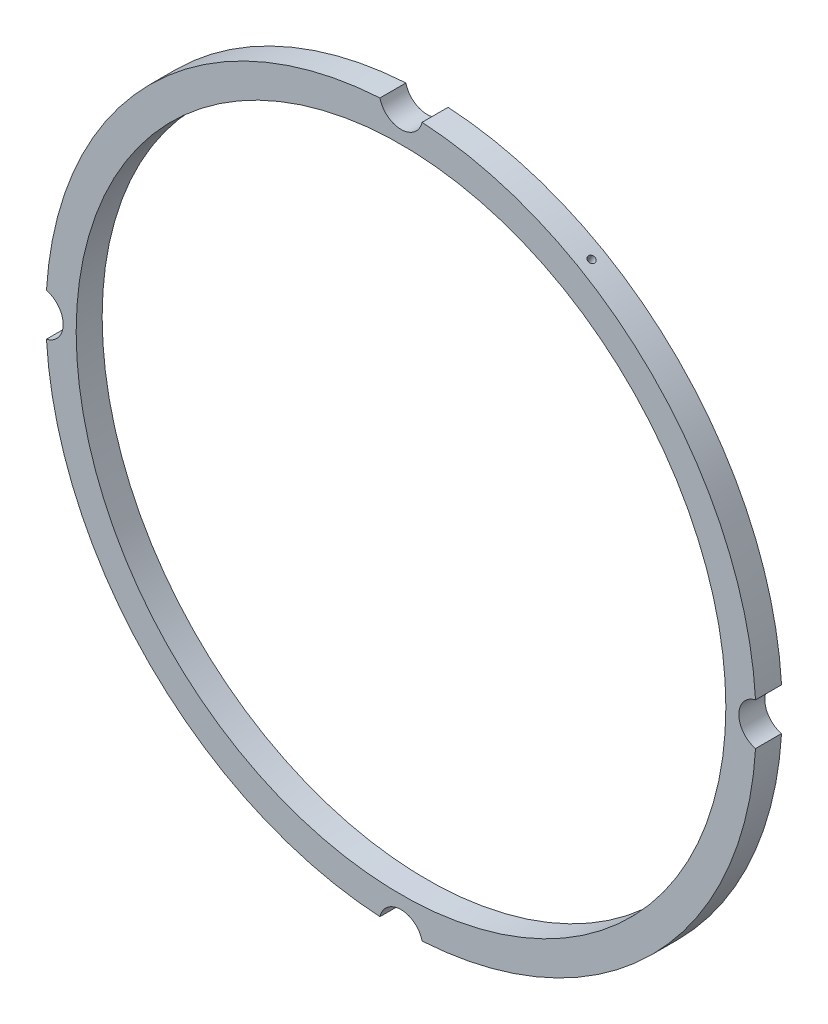
from build123d import *

# Parameters (mm, degrees)
SKETCH1_R                 = 82
SKETCH1_R_2               = 75
BOSS_EXTRUDE1_DEPTH       = 6
SKETCH2_R                 = 5
CUT_EXTRUDE1_DEPTH        = 117.120626936
CIRPATTERN1_COUNT         = 4
M2X0_4_TAPPED_HOLE1_D     = 1.6
M2X0_4_TAPPED_HOLE1_DEPTH = 10
M2X0_4_TAPPED_HOLE1_TIP   = 0.480688495


with BuildPart() as part:
    # Sketch1 → Boss-Extrude1 (new body)
    with BuildSketch(Plane.XY):
        Circle(SKETCH1_R)
        Circle(SKETCH1_R_2, mode=Mode.SUBTRACT)
    extrude(amount=BOSS_EXTRUDE1_DEPTH)

    # Sketch2 → Cut-Extrude1 (cut, through all)
    with BuildSketch(Plane.XY.offset(6)):
        with Locations((0, 83)):
            Circle(SKETCH2_R)
    cut_extrude1 = extrude(amount=-CUT_EXTRUDE1_DEPTH, mode=Mode.SUBTRACT)

    # CirPattern1: Cut-Extrude1 ×4 about axis
    cirpattern1_axis = Axis((0, 0, 0), (0, 0, 1))
    for i in range(1, CIRPATTERN1_COUNT):
        add(cut_extrude1.rotate(cirpattern1_axis, i * 360 / CIRPATTERN1_COUNT), mode=Mode.SUBTRACT)

    # M2x0.4 Tapped Hole1
    with Locations(Plane(origin=(41, 71.01408311, 3), x_dir=(0.866025403784, -0.5, 0), z_dir=(0.5, 0.866025403784, 0))):
        with Locations((0, 0)):
            Hole(M2X0_4_TAPPED_HOLE1_D / 2, depth=M2X0_4_TAPPED_HOLE1_DEPTH)
            with Locations((0, 0, -(M2X0_4_TAPPED_HOLE1_DEPTH + M2X0_4_TAPPED_HOLE1_TIP / 2))):  # 118° drill point
                Cone(0, M2X0_4_TAPPED_HOLE1_D / 2, M2X0_4_TAPPED_HOLE1_TIP, mode=Mode.SUBTRACT)


solid = part.part
